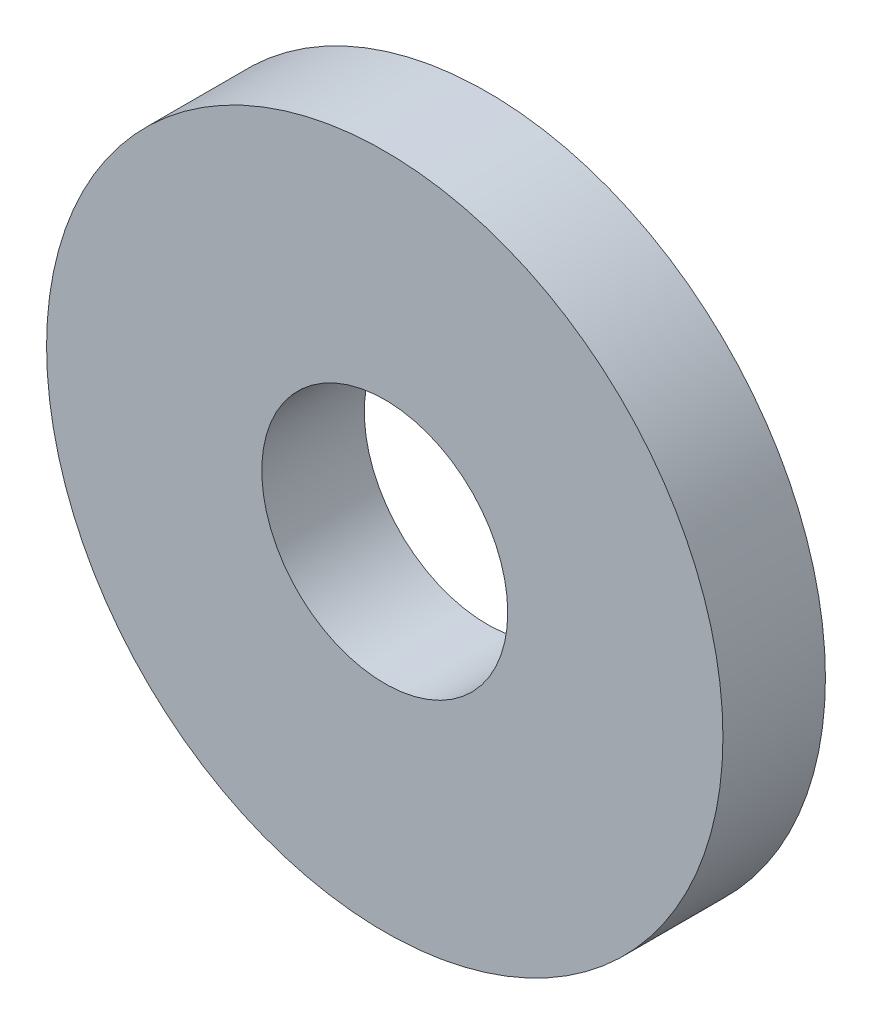
from build123d import *

# Parameters (mm, degrees)
SKETCH1_R           = 16.5
SKETCH1_R_2         = 6
BOSS_EXTRUDE1_DEPTH = 5


with BuildPart() as part:
    # Sketch1 → Boss-Extrude1 (new body)
    with BuildSketch(Plane.XY):
        with Locations((-94.301272012, 77.23010703)):
            Circle(SKETCH1_R)
        with Locations((-94.301272012, 77.23010703)):
            Circle(SKETCH1_R_2, mode=Mode.SUBTRACT)
    extrude(amount=BOSS_EXTRUDE1_DEPTH)


solid = part.part
